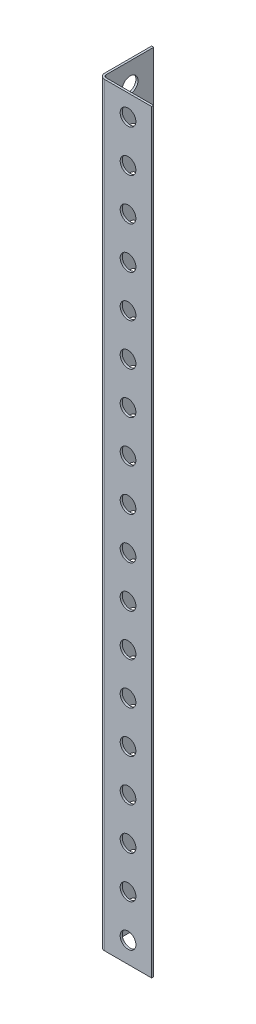
from build123d import *

# Parameters (mm, degrees)
BOSS_EXTRUDE1_DEPTH = 1219.2
SKETCH3_R           = 4.7625
CUT_EXTRUDE1_DEPTH  = 1.27
SKETCH4_R           = 4.7625
CUT_EXTRUDE2_DEPTH  = 1.27
FILLET1_R           = 3.175
FILLET2_R           = 1.5875
CUT_EXTRUDE3_DEPTH  = 762


with BuildPart() as part:
    # Sketch1 → Boss-Extrude1 (new body)
    with BuildSketch(Plane(origin=(0, 0, 0), x_dir=(1, 0, 0), z_dir=(0, 1, 0))):
        Polygon((1.27, 1.27), (1.27, 30.48), (1.27, 31.75), (0, 31.75), (0, 0), (31.75, 0), (31.75, 1.27), (30.48, 1.27), align=None)
    extrude(amount=BOSS_EXTRUDE1_DEPTH)

    # Sketch3 → Cut-Extrude1 (cut)
    with BuildSketch(Plane.ZY):
        with Locations((-17.4625, 12.7)):
            Circle(SKETCH3_R)
        with Locations((-17.4625, 38.1)):
            Circle(SKETCH3_R)
        with Locations((-17.4625, 63.5)):
            Circle(SKETCH3_R)
        with Locations((-17.4625, 88.9)):
            Circle(SKETCH3_R)
        with Locations((-17.4625, 114.3)):
            Circle(SKETCH3_R)
        with Locations((-17.4625, 139.7)):
            Circle(SKETCH3_R)
        with Locations((-17.4625, 165.1)):
            Circle(SKETCH3_R)
        with Locations((-17.4625, 190.5)):
            Circle(SKETCH3_R)
        with Locations((-17.4625, 215.9)):
            Circle(SKETCH3_R)
        with Locations((-17.4625, 241.3)):
            Circle(SKETCH3_R)
        with Locations((-17.4625, 266.7)):
            Circle(SKETCH3_R)
        with Locations((-17.4625, 292.1)):
            Circle(SKETCH3_R)
        with Locations((-17.4625, 317.5)):
            Circle(SKETCH3_R)
        with Locations((-17.4625, 342.9)):
            Circle(SKETCH3_R)
        with Locations((-17.4625, 368.3)):
            Circle(SKETCH3_R)
        with Locations((-17.4625, 393.7)):
            Circle(SKETCH3_R)
        with Locations((-17.4625, 419.1)):
            Circle(SKETCH3_R)
        with Locations((-17.4625, 444.5)):
            Circle(SKETCH3_R)
        with Locations((-17.4625, 469.9)):
            Circle(SKETCH3_R)
        with Locations((-17.4625, 495.3)):
            Circle(SKETCH3_R)
        with Locations((-17.4625, 520.7)):
            Circle(SKETCH3_R)
        with Locations((-17.4625, 546.1)):
            Circle(SKETCH3_R)
        with Locations((-17.4625, 571.5)):
            Circle(SKETCH3_R)
        with Locations((-17.4625, 596.9)):
            Circle(SKETCH3_R)
        with Locations((-17.4625, 622.3)):
            Circle(SKETCH3_R)
        with Locations((-17.4625, 647.7)):
            Circle(SKETCH3_R)
        with Locations((-17.4625, 673.1)):
            Circle(SKETCH3_R)
        with Locations((-17.4625, 698.5)):
            Circle(SKETCH3_R)
        with Locations((-17.4625, 723.9)):
            Circle(SKETCH3_R)
        with Locations((-17.4625, 749.3)):
            Circle(SKETCH3_R)
        with Locations((-17.4625, 774.7)):
            Circle(SKETCH3_R)
        with Locations((-17.4625, 800.1)):
            Circle(SKETCH3_R)
        with Locations((-17.4625, 825.5)):
            Circle(SKETCH3_R)
        with Locations((-17.4625, 850.9)):
            Circle(SKETCH3_R)
        with Locations((-17.4625, 876.3)):
            Circle(SKETCH3_R)
        with Locations((-17.4625, 901.7)):
            Circle(SKETCH3_R)
        with Locations((-17.4625, 927.1)):
            Circle(SKETCH3_R)
        with Locations((-17.4625, 952.5)):
            Circle(SKETCH3_R)
        with Locations((-17.4625, 977.9)):
            Circle(SKETCH3_R)
        with Locations((-17.4625, 1003.3)):
            Circle(SKETCH3_R)
        with Locations((-17.4625, 1028.7)):
            Circle(SKETCH3_R)
        with Locations((-17.4625, 1054.1)):
            Circle(SKETCH3_R)
        with Locations((-17.4625, 1079.5)):
            Circle(SKETCH3_R)
        with Locations((-17.4625, 1104.9)):
            Circle(SKETCH3_R)
        with Locations((-17.4625, 1130.3)):
            Circle(SKETCH3_R)
        with Locations((-17.4625, 1155.7)):
            Circle(SKETCH3_R)
        with Locations((-17.4625, 1181.1)):
            Circle(SKETCH3_R)
        with Locations((-17.4625, 1206.5)):
            Circle(SKETCH3_R)
    extrude(amount=-CUT_EXTRUDE1_DEPTH, mode=Mode.SUBTRACT)

    # Sketch4 → Cut-Extrude2 (cut)
    with BuildSketch(Plane.XY):
        with Locations((17.4625, 1206.5)):
            Circle(SKETCH4_R)
        with Locations((17.4625, 1181.1)):
            Circle(SKETCH4_R)
        with Locations((17.4625, 1155.7)):
            Circle(SKETCH4_R)
        with Locations((17.4625, 1130.3)):
            Circle(SKETCH4_R)
        with Locations((17.4625, 1104.9)):
            Circle(SKETCH4_R)
        with Locations((17.4625, 1079.5)):
            Circle(SKETCH4_R)
        with Locations((17.4625, 1054.1)):
            Circle(SKETCH4_R)
        with Locations((17.4625, 1028.7)):
            Circle(SKETCH4_R)
        with Locations((17.4625, 1003.3)):
            Circle(SKETCH4_R)
        with Locations((17.4625, 977.9)):
            Circle(SKETCH4_R)
        with Locations((17.4625, 952.5)):
            Circle(SKETCH4_R)
        with Locations((17.4625, 927.1)):
            Circle(SKETCH4_R)
        with Locations((17.4625, 901.7)):
            Circle(SKETCH4_R)
        with Locations((17.4625, 876.3)):
            Circle(SKETCH4_R)
        with Locations((17.4625, 850.9)):
            Circle(SKETCH4_R)
        with Locations((17.4625, 825.5)):
            Circle(SKETCH4_R)
        with Locations((17.4625, 800.1)):
            Circle(SKETCH4_R)
        with Locations((17.4625, 774.7)):
            Circle(SKETCH4_R)
        with Locations((17.4625, 749.3)):
            Circle(SKETCH4_R)
        with Locations((17.4625, 723.9)):
            Circle(SKETCH4_R)
        with Locations((17.4625, 698.5)):
            Circle(SKETCH4_R)
        with Locations((17.4625, 673.1)):
            Circle(SKETCH4_R)
        with Locations((17.4625, 647.7)):
            Circle(SKETCH4_R)
        with Locations((17.4625, 622.3)):
            Circle(SKETCH4_R)
        with Locations((17.4625, 596.9)):
            Circle(SKETCH4_R)
        with Locations((17.4625, 571.5)):
            Circle(SKETCH4_R)
        with Locations((17.4625, 546.1)):
            Circle(SKETCH4_R)
        with Locations((17.4625, 520.7)):
            Circle(SKETCH4_R)
        with Locations((17.4625, 495.3)):
            Circle(SKETCH4_R)
        with Locations((17.4625, 469.9)):
            Circle(SKETCH4_R)
        with Locations((17.4625, 444.5)):
            Circle(SKETCH4_R)
        with Locations((17.4625, 419.1)):
            Circle(SKETCH4_R)
        with Locations((17.4625, 393.7)):
            Circle(SKETCH4_R)
        with Locations((17.4625, 368.3)):
            Circle(SKETCH4_R)
        with Locations((17.4625, 342.9)):
            Circle(SKETCH4_R)
        with Locations((17.4625, 317.5)):
            Circle(SKETCH4_R)
        with Locations((17.4625, 292.1)):
            Circle(SKETCH4_R)
        with Locations((17.4625, 266.7)):
            Circle(SKETCH4_R)
        with Locations((17.4625, 241.3)):
            Circle(SKETCH4_R)
        with Locations((17.4625, 215.9)):
            Circle(SKETCH4_R)
        with Locations((17.4625, 190.5)):
            Circle(SKETCH4_R)
        with Locations((17.4625, 165.1)):
            Circle(SKETCH4_R)
        with Locations((17.4625, 139.7)):
            Circle(SKETCH4_R)
        with Locations((17.4625, 114.3)):
            Circle(SKETCH4_R)
        with Locations((17.4625, 88.9)):
            Circle(SKETCH4_R)
        with Locations((17.4625, 63.5)):
            Circle(SKETCH4_R)
        with Locations((17.4625, 38.1)):
            Circle(SKETCH4_R)
        with Locations((17.4625, 12.7)):
            Circle(SKETCH4_R)
    extrude(amount=-CUT_EXTRUDE2_DEPTH, mode=Mode.SUBTRACT)

    # Fillet1
    fillet1_edges = [part.edges().sort_by_distance(p)[0] for p in [
        (0, 609.6, 0),
    ]]
    fillet(fillet1_edges, radius=FILLET1_R)

    # Fillet2
    fillet2_edges = [part.edges().sort_by_distance(p)[0] for p in [
        (1.27, 609.6, -1.27),
    ]]
    fillet(fillet2_edges, radius=FILLET2_R)

    # Sketch5 → Cut-Extrude3 (cut)
    with BuildSketch(Plane(origin=(0, 1219.2, 0), x_dir=(1, 0, 0), z_dir=(0, 1, 0))):
        with BuildLine():
            Line((0, 31.75), (0, 3.175))
            ThreePointArc((0, 3.175), (0.92993597, 0.92993597), (3.175, 0))
            Line((3.175, 0), (31.75, 0))
            Line((31.75, 0), (31.75, 1.27))
            Line((31.75, 1.27), (2.8575, 1.27))
            ThreePointArc((2.8575, 1.27), (1.734967985, 1.734967985), (1.27, 2.8575))
            Line((1.27, 2.8575), (1.27, 31.75))
            Line((1.27, 31.75), (0, 31.75))
        make_face()
    extrude(amount=-CUT_EXTRUDE3_DEPTH, mode=Mode.SUBTRACT)


solid = part.part
